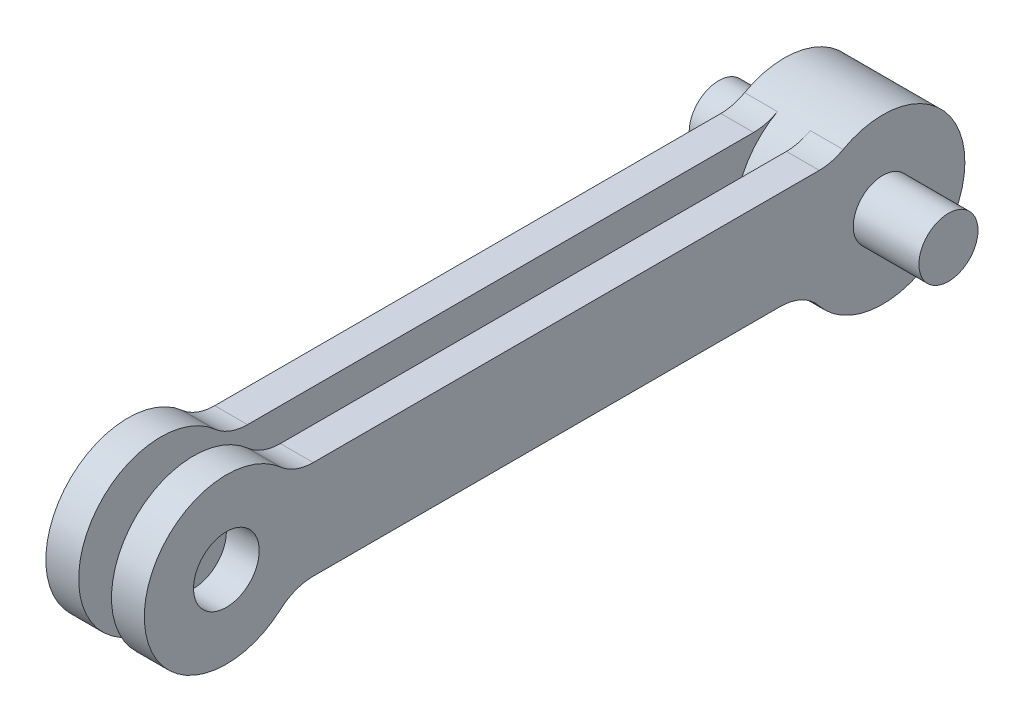
from build123d import *
from build123d.topology import SkipClean

# Parameters (mm, degrees)
SKETCH_1_R               = 5
SKETCH_1_W               = 40
SKETCH_1_H               = 6
EXTRUDE_1_DEPTH          = 2
CUT_EXTRUDE_2_DEPTH      = 46.44227107
CUT_EXTRUDE_2_DEPTH_BACK = 46.44227107
SKETCH_1_3_R             = 2
FILLET_1_R               = 3
EXTRUDE_START            = -1
EXTRUDE_2_DEPTH          = 1
SKETCH_2_R               = 2
EXTRUDE_3_DEPTH          = 6
SKETCH_2_3_R             = 1.8
EXTRUDE_4_DEPTH          = 4
EXTRUDE_START_2          = -10
SKETCH_2_4_R             = 1.8
EXTRUDE_5_DEPTH          = 4


with BuildPart() as part:
    # 草图1 → 凸台-拉伸1 (new body)
    with BuildSketch(Plane(origin=(0, 0, 0), x_dir=(0, 0, -1), z_dir=(1, 0, 0))):
        Circle(SKETCH_1_R)
        with Locations((40, -1)):
            Circle(SKETCH_1_R)
        with Locations((20, 0)):
            Rectangle(SKETCH_1_W, SKETCH_1_H)
    extrude(amount=EXTRUDE_1_DEPTH)

    # 草图1<3> → 切除-拉伸2 (cut, two sides: drawn at the far end of the back side and taken through both)
    with BuildSketch(Plane(origin=(0, 0, 0), x_dir=(0, 0, -1), z_dir=(1, 0, 0)).offset(-CUT_EXTRUDE_2_DEPTH_BACK)):
        Circle(SKETCH_1_3_R)
        with Locations((40, -1)):
            Circle(SKETCH_1_3_R)
    extrude(amount=CUT_EXTRUDE_2_DEPTH + CUT_EXTRUDE_2_DEPTH_BACK, mode=Mode.SUBTRACT)

    # 圆角1
    fillet_1_edges = [part.edges().sort_by_distance(p)[0] for p in [
        (1, -3, -35.417424305),
        (1, 3, -37),
        (1, 3, -4),
        (1, -3, -4),
    ]]
    fillet(fillet_1_edges, radius=FILLET_1_R)

    # 草图1<4> → 凸台-拉伸2 (add)
    with SkipClean():  # the faces are left unmerged after this step: merging them gives an invalid solid
        with BuildSketch(Plane(origin=(0, 0, 0), x_dir=(0, 0, -1), z_dir=(1, 0, 0)).offset(EXTRUDE_START)):
            with BuildLine():
                ThreePointArc((37, 3), (35.16534763, 0.275200556), (35.417424305, -3))
                Line((35.417424305, -3), (40, -3))
                ThreePointArc((40, -3), (38, -1), (40, 1))
                Line((40, 1), (40, 3))
                Line((40, 3), (37, 3))
            make_face()
            with BuildLine():
                Line((40, -3), (35.417424305, -3))
                ThreePointArc((35.417424305, -3), (41.021548218, -5.894531565), (45, -1))
                ThreePointArc((45, -1), (42.236067977, 3.472135955), (37, 3))
                Line((37, 3), (40, 3))
                Line((40, 3), (40, 1))
                ThreePointArc((40, 1), (41.414213562, 0.414213562), (42, -1))
                ThreePointArc((42, -1), (41.414213562, -2.414213562), (40, -3))
            make_face()
        extrude(amount=EXTRUDE_2_DEPTH)

    # 镜向3: part across plane


with BuildPart() as part_1:
    add(part.part)
    add(part.part.mirror(Plane.ZY.offset(1)))

    # 草图2 → 凸台-拉伸3 (add)
    with BuildSketch(Plane(origin=(2, 0, 0), x_dir=(0, 0, -1), z_dir=(1, 0, 0))):
        with Locations((40, -1)):
            Circle(SKETCH_2_R)
    extrude(amount=-EXTRUDE_3_DEPTH)

    # 草图2<3> → 凸台-拉伸4 (add)
    with BuildSketch(Plane(origin=(2, 0, 0), x_dir=(0, 0, -1), z_dir=(1, 0, 0))):
        with Locations((40, -1)):
            Circle(SKETCH_2_3_R)
    extrude(amount=EXTRUDE_4_DEPTH)

    # 草图2<4> → 凸台-拉伸5 (add)
    with BuildSketch(Plane(origin=(2, 0, 0), x_dir=(0, 0, -1), z_dir=(1, 0, 0)).offset(EXTRUDE_START_2)):
        with Locations((40, -1)):
            Circle(SKETCH_2_4_R)
    extrude(amount=EXTRUDE_5_DEPTH)


solid = part_1.part
